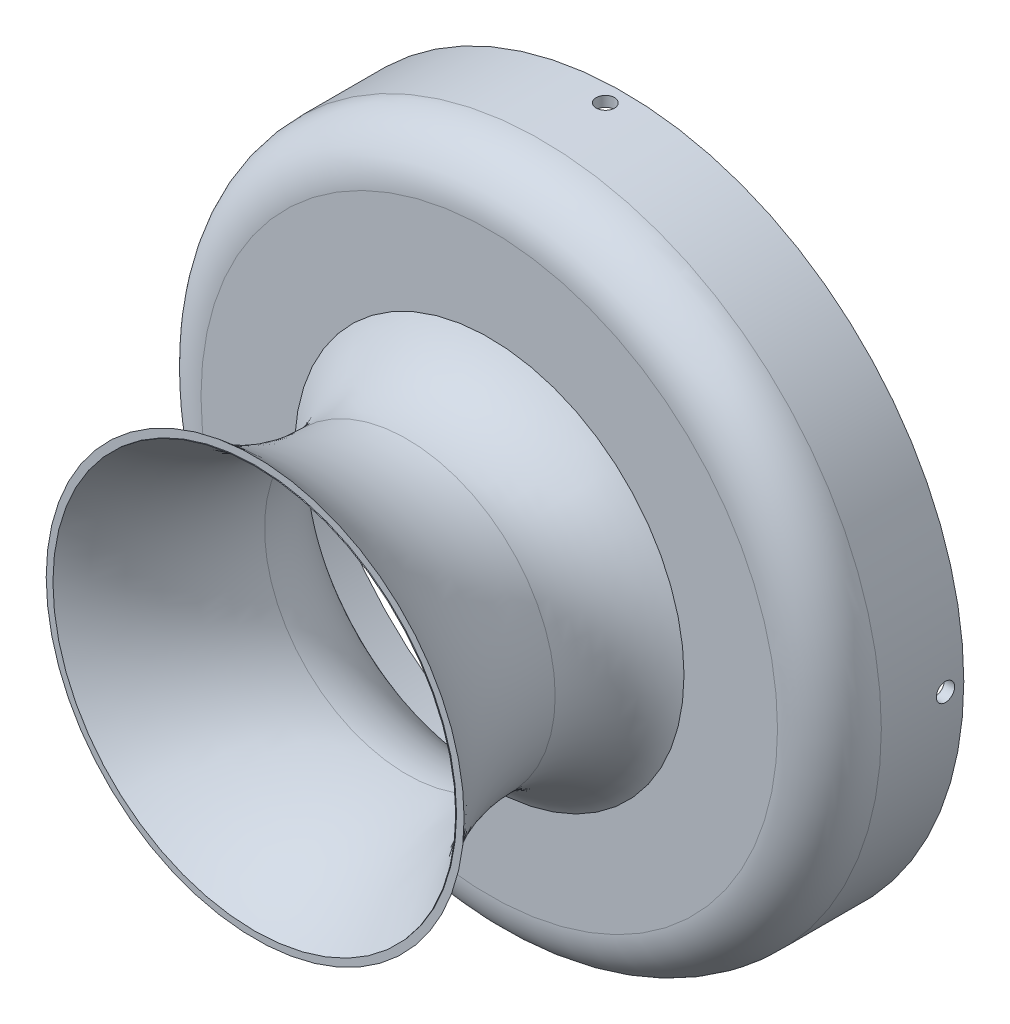
from build123d import *

# Parameters (mm, degrees)
SKETCH2_R          = 1.5
CUT_EXTRUDE1_DEPTH = 10
CIRPATTERN1_COUNT  = 4


with BuildPart() as part:
    # Sketch1 → Revolve1 (revolve)
    with BuildSketch(Plane(origin=(0, 0, 0), x_dir=(1, 0, 0), z_dir=(0, 1, 0)), mode=Mode.PRIVATE) as revolve1_sk:
        with BuildLine():
            Line((-33.620030864, 40.5), (-47.2, 40.5))
            ThreePointArc((-47.2, 40.5), (-51.796194078, 42.403805922), (-53.7, 47))
            Line((-53.7, 47), (-53.7, 47.5))
            Line((-53.7, 47.5), (-53.7, 47.7))
            Line((-53.7, 47.7), (-54, 47.7))
            Line((-54, 47.7), (-54, 49.5))
            Line((-54, 49.5), (-54, 60.5))
            Line((-54, 60.5), (-55.7, 60.5))
            Line((-55.7, 60.5), (-55.7, 47))
            ThreePointArc((-55.7, 47), (-53.21040764, 40.98959236), (-47.2, 38.5))
            Line((-47.2, 38.5), (-31.890858754, 38.5))
            ThreePointArc((-31.890858754, 38.5), (-26.327846361, 32.743886889), (-24.3, 25))
            Line((-24.3, 25), (-23.3, 25))
            ThreePointArc((-23.3, 25), (-26.116018423, 34.310652999), (-33.620030864, 40.5))
        make_face()
    revolve(revolve1_sk.sketch.rotate(Axis((0, 0, 0), (0, 0, -1)), 180), axis=Axis((0, 0, 0), (0, 0, -1)))

    # Sketch2 → Cut-Extrude1 (cut)
    with BuildSketch(Plane(origin=(0, 55.7, 0), x_dir=(1, 0, 0), z_dir=(0, 1, 0))):
        with Locations(Location((0, 57.5, 0), (0, 0, 270))):
            Circle(SKETCH2_R)
    cut_extrude1 = extrude(amount=-CUT_EXTRUDE1_DEPTH, mode=Mode.SUBTRACT)

    # CirPattern1: Cut-Extrude1 ×4 about axis
    cirpattern1_axis = Axis((0, 0, 0), (0, 0, 1))
    for i in range(1, CIRPATTERN1_COUNT):
        add(cut_extrude1.rotate(cirpattern1_axis, i * 360 / CIRPATTERN1_COUNT), mode=Mode.SUBTRACT)

    # Sketch4 → Revolve2 (revolve)
    with BuildSketch(Plane(origin=(0, 0, 0), x_dir=(1, 0, 0), z_dir=(0, 1, 0)), mode=Mode.PRIVATE) as revolve2_sk:
        with BuildLine():
            Line((-24.3, 25), (-23.3, 25))
            ThreePointArc((-23.3, 25), (-25.812155139, 11.590644472), (-33.007896924, 0))
            Line((-33.007896924, 0), (-34.379125514, 0))
            ThreePointArc((-34.379125514, 0), (-26.914612018, 11.522344685), (-24.3, 25))
        make_face()
    revolve(revolve2_sk.sketch.rotate(Axis((0, 0, 0), (0, 0, -1)), 180), axis=Axis((0, 0, 0), (0, 0, -1)))

    # Sketch12 → Cut-Revolve2 (revolve, cut)
    with BuildSketch(Plane(origin=(0, 0, 0), x_dir=(0, 0, -1), z_dir=(1, 0, 0)), mode=Mode.PRIVATE) as cut_revolve2_sk:
        Polygon((0.171963045, 34.804821283), (0.171963045, 32.977261807), (-3.294935837, 32.977261807), align=None)
    revolve(cut_revolve2_sk.sketch.rotate(Axis((0, 0, 33.840895414), (0, 0, -1)), 90), axis=Axis((0, 0, 33.840895414), (0, 0, -1)), mode=Mode.SUBTRACT)


solid = part.part
